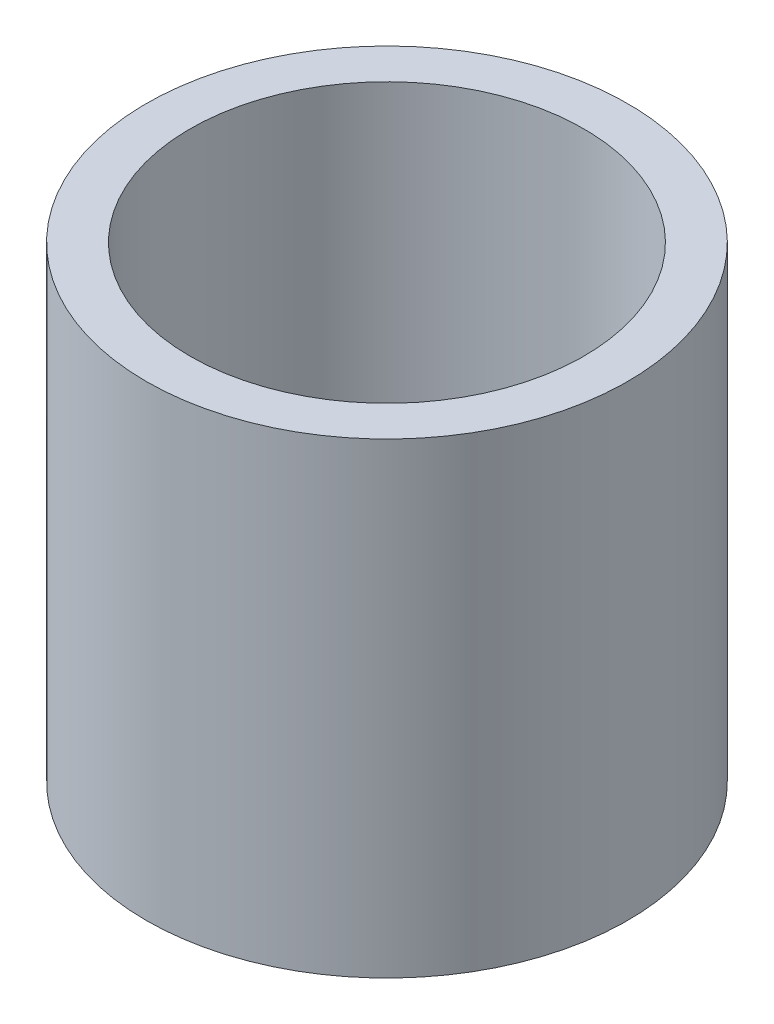
from build123d import *

# Parameters (mm, degrees)
SKETCH2_W = 9.525
SKETCH2_H = 101.6


with BuildPart() as part:
    # Sketch2 → Revolve1 (revolve)
    with BuildSketch(Plane.XY, mode=Mode.PRIVATE) as revolve1_sk:
        with Locations((47.625, -50.8)):
            Rectangle(SKETCH2_W, SKETCH2_H)
    revolve(revolve1_sk.sketch.rotate(Axis((0, 2.54, 0), (0, -1, 0)), 90), axis=Axis((0, 2.54, 0), (0, -1, 0)))


solid = part.part
